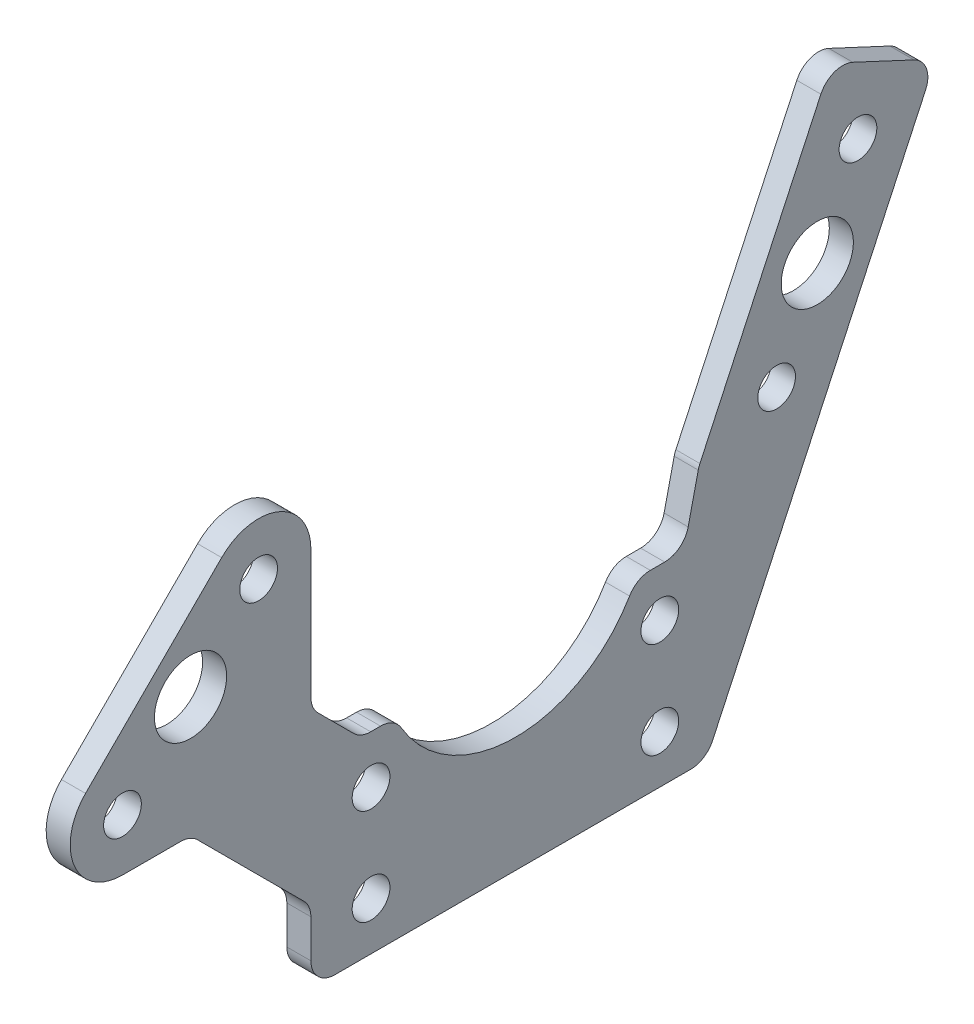
from build123d import *

# Parameters (mm, degrees)
SKETCH1_R           = 2.4892
SKETCH1_R_2         = 4.7625
BOSS_EXTRUDE1_DEPTH = 1.5875
FILLET1_R           = 3.175
SKETCH2_R           = 4.7625
SKETCH2_R_2         = 2.4892
BOSS_EXTRUDE2_DEPTH = 3.175
FILLET2_R           = 3.175


with BuildPart() as part:
    # Sketch1 → Boss-Extrude1 (new, symmetric)
    with BuildSketch(Plane(origin=(0, 0, 0), x_dir=(0, 0, -1), z_dir=(1, 0, 0))):
        with BuildLine():
            Line((6.894743879, 0), (15.875, 0))
            Line((15.875, 0), (31.75, -15.875))
            Line((31.75, -15.875), (31.75, -25.4))
            Line((31.75, -25.4), (84.1375, -25.4))
            Line((84.1375, -25.4), (84.1375, 0))
            Line((84.1375, 0), (74.6125, 0))
            ThreePointArc((74.6125, 0), (58.7375, -10.187661084), (42.8625, 0))
            Line((42.8625, 0), (38.325640303, 0))
            Line((38.325640303, 0), (31.75, 6.575640303))
            Line((31.75, 6.575640303), (31.75, 24.855256121))
            ThreePointArc((31.75, 24.855256121), (27.493760374, 31.225168873), (19.97993597, 29.730576272))
            Line((19.97993597, 29.730576272), (2.019423728, 11.77006403))
            ThreePointArc((2.019423728, 11.77006403), (0.524831127, 4.256239626), (6.894743879, 0))
        make_face()
        with Locations((6.894743879, 6.894743879)):
            Circle(SKETCH1_R, mode=Mode.SUBTRACT)
        with Locations((15.875, 15.875)):
            Circle(SKETCH1_R_2, mode=Mode.SUBTRACT)
        with Locations((24.855256121, 24.855256121)):
            Circle(SKETCH1_R, mode=Mode.SUBTRACT)
        with Locations((77.7875, -19.05)):
            Circle(SKETCH1_R, mode=Mode.SUBTRACT)
        with Locations((77.7875, -6.35)):
            Circle(SKETCH1_R, mode=Mode.SUBTRACT)
        with Locations((39.6875, -19.05)):
            Circle(SKETCH1_R, mode=Mode.SUBTRACT)
        with Locations((39.6875, -6.35)):
            Circle(SKETCH1_R, mode=Mode.SUBTRACT)
    extrude(amount=BOSS_EXTRUDE1_DEPTH, both=True)

    # Fillet1
    fillet1_edges = [part.edges().sort_by_distance(p)[0] for p in [
        (0, 0, -42.8625),
        (0, 0, -74.6125),
        (0, 0, -84.1375),
        (0, -25.4, -84.1375),
        (0, -25.4, -31.75),
        (0, -15.875, -31.75),
        (0, 0, -15.875),
        (0, 6.575640303, -31.75),
        (0, 0, -38.325640303),
    ]]
    fillet(fillet1_edges, radius=FILLET1_R)

    # Sketch2 → Boss-Extrude2 (add)
    # profile 1 of 2: a face of its own
    with BuildSketch(Plane(origin=(1.5875, 0, 0), x_dir=(0, 0, -1), z_dir=(1, 0, 0))):
        with BuildLine():
            Line((83.884613573, -25.4), (80.9625, -25.4))
            ThreePointArc((80.9625, -25.4), (83.20756403, -24.47006403), (84.1375, -22.225))
            Line((84.1375, -22.225), (84.1375, -3.175))
            ThreePointArc((84.1375, -3.175), (83.20756403, -0.92993597), (80.9625, 0))
            Line((80.9625, 0), (82.933508182, 8.621260033))
            Line((82.933508182, 8.621260033), (96.745638856, 2.180557724))
            Line((96.745638856, 2.180557724), (83.884613573, -25.4))
        make_face()
    # profile 2 of 2: a face of its own
    with BuildSketch(Plane(origin=(1.5875, 0, 0), x_dir=(0, 0, -1), z_dir=(1, 0, 0))):
        Polygon((100.377076935, 46.029113943), (114.18920761, 39.588411634), (96.745638856, 2.180557724), (82.933508182, 8.621260033), align=None)
        with Locations((98.561357896, 24.104835834)):
            Circle(SKETCH2_R, mode=Mode.SUBTRACT)
        with Locations((93.194105972, 12.594726938)):
            Circle(SKETCH2_R_2, mode=Mode.SUBTRACT)
        with Locations((103.92860982, 35.614944729)):
            Circle(SKETCH2_R_2, mode=Mode.SUBTRACT)
    extrude(amount=-BOSS_EXTRUDE2_DEPTH)

    # Fillet2
    fillet2_edges = [part.edges().sort_by_distance(p)[0] for p in [
        (0, 39.588411634, -114.18920761),
        (0, 46.029113943, -100.377076935),
        (0, 8.621260033, -82.933508182),
        (0, -25.4, -83.884613573),
        (0, 0, -80.9625),
    ]]
    fillet(fillet2_edges, radius=FILLET2_R)


solid = part.part
